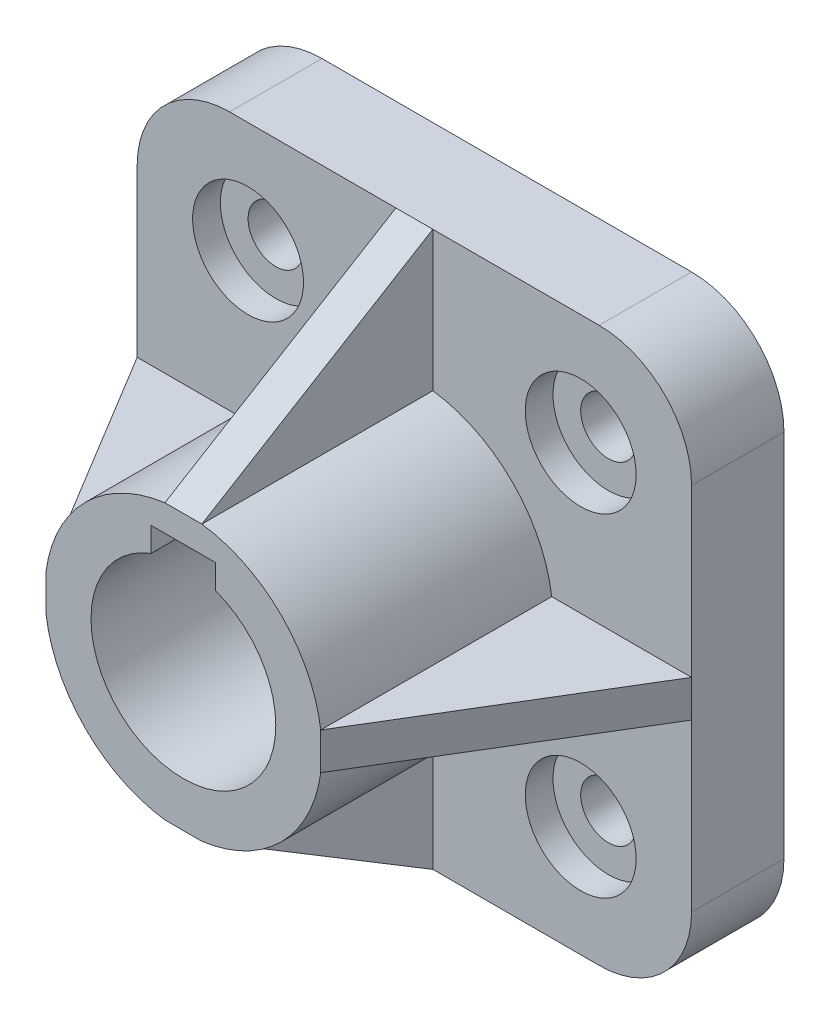
from build123d import *

# Parameters (mm, degrees)
Y_KSEKLIK_EKSTR_ZYON1_DEPTH = 20
IZIM2_R                     = 12
KES_EKSTR_ZYON1_DEPTH       = 6
IZIM3_R                     = 6
KES_EKSTR_ZYON2_DEPTH       = 88.177978871
Y_KSEKLIK_EKSTR_ZYON2_DEPTH = 50
KES_EKSTR_ZYON3_DEPTH       = 111
KES_EKSTR_ZYON4_DEPTH       = 113.231902773
KES_EKSTR_ZYON5_DEPTH       = 113.231902773
KES_EKSTR_ZYON6_DEPTH       = 113.231902773


with BuildPart() as part:
    # Çizim1 → Yükseklik-Ekstrüzyon1 (new body)
    with BuildSketch(Plane.XY):
        with BuildLine():
            Line((40, -60), (-40, -60))
            ThreePointArc((-40, -60), (-54.142135624, -54.142135624), (-60, -40))
            Line((-60, -40), (-60, 40))
            ThreePointArc((-60, 40), (-54.142135624, 54.142135624), (-40, 60))
            Line((-40, 60), (40, 60))
            ThreePointArc((40, 60), (54.142135624, 54.142135624), (60, 40))
            Line((60, 40), (60, -40))
            ThreePointArc((60, -40), (54.142135624, -54.142135624), (40, -60))
        make_face()
    extrude(amount=Y_KSEKLIK_EKSTR_ZYON1_DEPTH)

    # Çizim2 → Kes-Ekstrüzyon1 (cut)
    with BuildSketch(Plane.XY.offset(20)):
        with Locations((-36, 36)):
            Circle(IZIM2_R)
        with Locations((36, 36)):
            Circle(IZIM2_R)
        with Locations((-36, -36)):
            Circle(IZIM2_R)
        with Locations((36, -36)):
            Circle(IZIM2_R)
    extrude(amount=-KES_EKSTR_ZYON1_DEPTH, mode=Mode.SUBTRACT)

    # Çizim3 → Kes-Ekstrüzyon2 (cut, through all)
    with BuildSketch(Plane.XY.offset(20)):
        with Locations((-36, 36)):
            Circle(IZIM3_R)
        with Locations((36, 36)):
            Circle(IZIM3_R)
        with Locations((36, -36)):
            Circle(IZIM3_R)
        with Locations((-36, -36)):
            Circle(IZIM3_R)
    extrude(amount=-KES_EKSTR_ZYON2_DEPTH, mode=Mode.SUBTRACT)

    # Çizim4 → Yükseklik-Ekstrüzyon2 (add)
    with BuildSketch(Plane.XY.offset(20)):
        with BuildLine():
            Line((4, -60), (-4, -60))
            Line((-4, -60), (-4, -29.732137495))
            ThreePointArc((-4, -29.732137495), (-21.213203436, -21.213203436), (-29.732137495, -4))
            Line((-29.732137495, -4), (-60, -4))
            Line((-60, -4), (-60, 4))
            Line((-60, 4), (-29.732137495, 4))
            ThreePointArc((-29.732137495, 4), (-21.213203436, 21.213203436), (-4, 29.732137495))
            Line((-4, 29.732137495), (-4, 60))
            Line((-4, 60), (4, 60))
            Line((4, 60), (4, 29.732137495))
            ThreePointArc((4, 29.732137495), (21.213203436, 21.213203436), (29.732137495, 4))
            Line((29.732137495, 4), (60, 4))
            Line((60, 4), (60, -4))
            Line((60, -4), (29.732137495, -4))
            ThreePointArc((29.732137495, -4), (21.213203436, -21.213203436), (4, -29.732137495))
            Line((4, -29.732137495), (4, -60))
        make_face()
    extrude(amount=Y_KSEKLIK_EKSTR_ZYON2_DEPTH)

    # Çizim5 → Kes-Ekstrüzyon3 (cut, through all)
    with BuildSketch(Plane.XY.offset(70)):
        with BuildLine():
            Line((7, 18.734993995), (7, 24))
            Line((7, 24), (-7, 24))
            Line((-7, 24), (-7, 18.734993995))
            ThreePointArc((-7, 18.734993995), (0, -20), (7, 18.734993995))
        make_face()
    extrude(amount=-KES_EKSTR_ZYON3_DEPTH, mode=Mode.SUBTRACT)

    # Çizim6 → Kes-Ekstrüzyon4 (cut, through all)
    with BuildSketch(Plane.ZY.offset(4)):
        Polygon((70, 60), (70, 29.732137495), (20, 60), align=None)
    extrude(amount=-KES_EKSTR_ZYON4_DEPTH, mode=Mode.SUBTRACT)

    # Çizim7 → Kes-Ekstrüzyon5 (cut, through all)
    with BuildSketch(Plane.ZY.offset(4)):
        Polygon((70, -29.732137495), (20, -60), (70, -60), align=None)
    extrude(amount=-KES_EKSTR_ZYON5_DEPTH, mode=Mode.SUBTRACT)

    # Çizim8 → Kes-Ekstrüzyon6 (cut, through all)
    with BuildSketch(Plane(origin=(0, 4, 0), x_dir=(1, 0, 0), z_dir=(0, 1, 0))):
        Polygon((-60, -20), (-29.732137495, -70), (-60, -70), align=None)
        Polygon((60, -20), (29.732137495, -70), (60, -70), align=None)
    extrude(amount=-KES_EKSTR_ZYON6_DEPTH, mode=Mode.SUBTRACT)


solid = part.part
